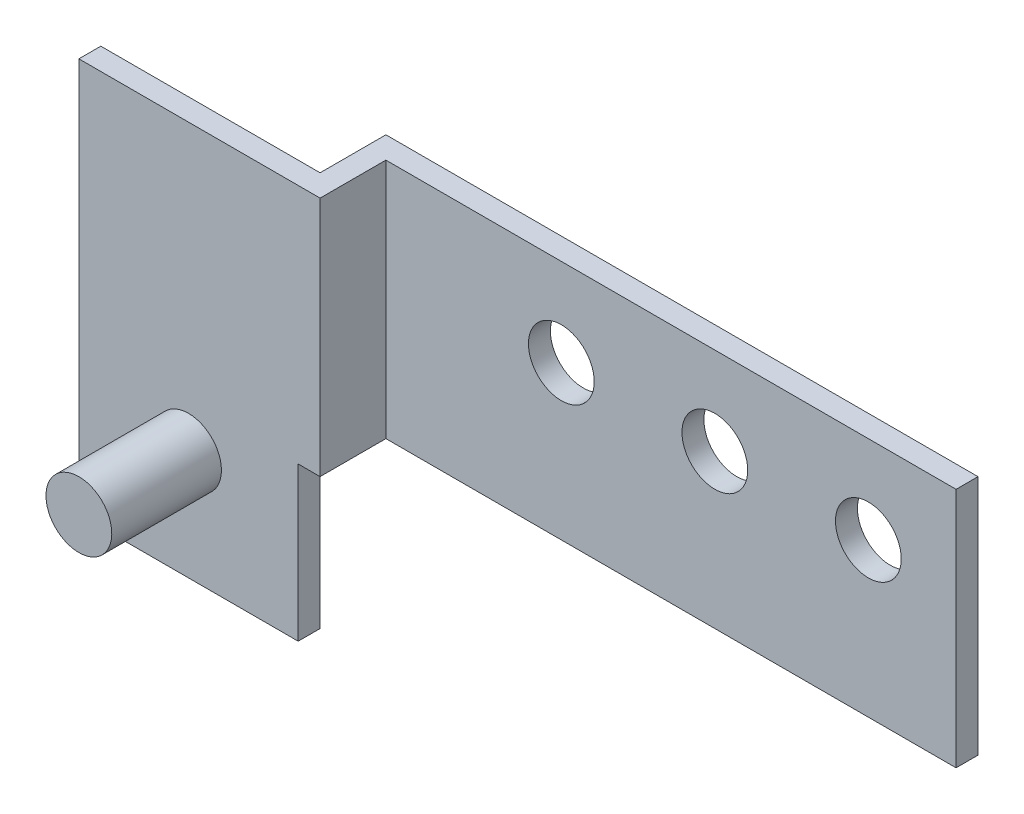
from build123d import *

# Parameters (mm, degrees)
SKETCH_1_W            = 37
SKETCH_1_H            = 18
EXTRUDE_1_DEPTH       = 1
SKETCH_2_W            = 27
SKETCH_2_H            = 7
CUT_EXTRUDE_1_DEPTH   = 33.465366161
SKETCH_3_W            = 27
SKETCH_3_H            = 11
EXTRUDE_2_DEPTH       = 3
SKETCH_4_W            = 26
SKETCH_4_H            = 3
CUT_EXTRUDE_2_DEPTH   = 30.427877939
SKETCH_5_W            = 1.5
SKETCH_5_H            = 5
HOLE_WIZARD_3_0_3_1_D = 3


with BuildPart() as part:
    # Эскиз1 → Бобышка-Вытянуть1 (new body)
    with BuildSketch(Plane.XY.offset(4)):
        with Locations((8.5, -9)):
            Rectangle(SKETCH_1_W, SKETCH_1_H)
    extrude(amount=-EXTRUDE_1_DEPTH)

    # Эскиз2 → Вырез-Вытянуть1 (cut, through all)
    with BuildSketch(Plane.XY.offset(4)):
        with Locations((13.5, -14.5)):
            Rectangle(SKETCH_2_W, SKETCH_2_H)
    extrude(amount=-CUT_EXTRUDE_1_DEPTH, mode=Mode.SUBTRACT)

    # Эскиз3 → Бобышка-Вытянуть2 (add)
    with BuildSketch(Plane(origin=(0, 0, 3), x_dir=(-1, 0, 0), z_dir=(0, 0, -1))):
        with Locations((-13.5, -5.5)):
            Rectangle(SKETCH_3_W, SKETCH_3_H)
    extrude(amount=EXTRUDE_2_DEPTH)

    # Эскиз4 → Вырез-Вытянуть2 (cut, through all)
    with BuildSketch(Plane.XZ.offset(11)):
        with Locations((14, 2.5)):
            Rectangle(SKETCH_4_W, SKETCH_4_H)
    extrude(amount=-CUT_EXTRUDE_2_DEPTH, mode=Mode.SUBTRACT)

    # Эскиз5 → Повернуть1 (revolve)
    with BuildSketch(Plane.XZ.offset(13), mode=Mode.PRIVATE) as revolve_1_sk:
        with Locations((-4.25, 6.5)):
            Rectangle(SKETCH_5_W, SKETCH_5_H)
    revolve(revolve_1_sk.sketch.rotate(Axis((-5, -13, 9), (0, 0, -1)), 270), axis=Axis((-5, -13, 9), (0, 0, -1)))

    # Диаметр отверстия Ø3.0 (3)1 (through all)
    with Locations(Plane.XY.offset(1)):
        with Locations((23, -4), (16, -4), (9, -4)):
            Hole(HOLE_WIZARD_3_0_3_1_D / 2)


solid = part.part
